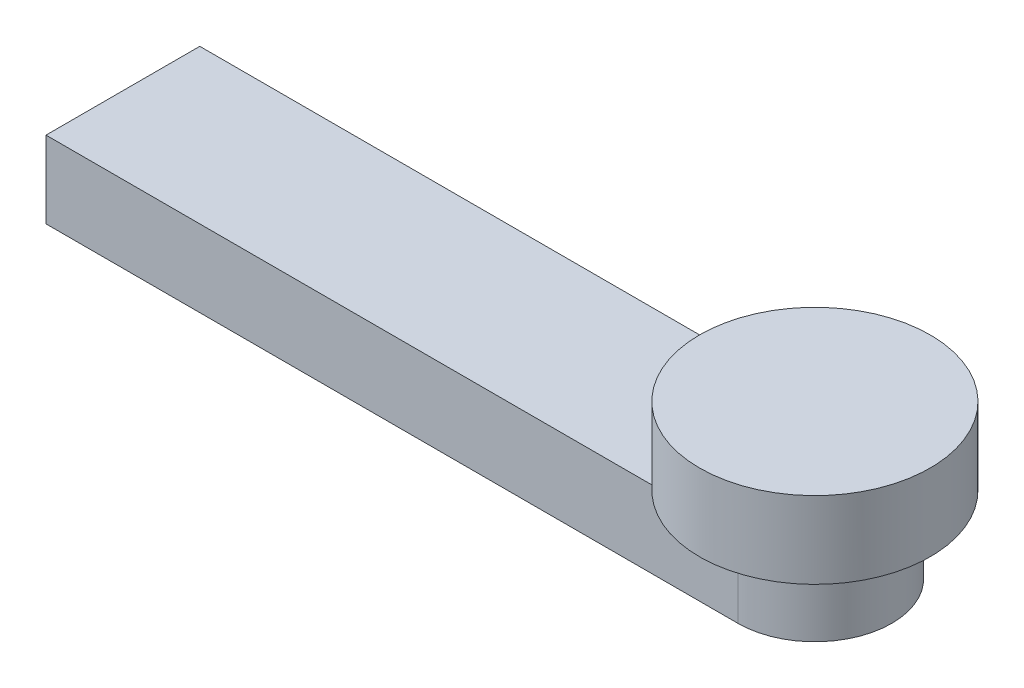
from build123d import *

# Parameters (mm, degrees)
ARM1_DEPTH          = 10
SKETCH3_R           = 15
BOSS_EXTRUDE2_DEPTH = 10


with BuildPart() as part:
    # Sketch1 → arm1 (new body)
    with BuildSketch(Plane(origin=(0, 0, 0), x_dir=(1, 0, 0), z_dir=(0, 1, 0))):
        with BuildLine():
            Line((-45, 10), (45, 10))
            ThreePointArc((45, 10), (55, 0), (45, -10))
            Line((45, -10), (-45, -10))
            Line((-45, -10), (-45, 10))
        make_face()
    extrude(amount=ARM1_DEPTH)

    # Sketch3 → Boss-Extrude2 (add)
    with BuildSketch(Plane(origin=(0, 10, 0), x_dir=(1, 0, 0), z_dir=(0, 1, 0))):
        with Locations(Location((45, 0, 0), (0, 0, 138.189685104))):
            Circle(SKETCH3_R)
    extrude(amount=BOSS_EXTRUDE2_DEPTH)


solid = part.part
